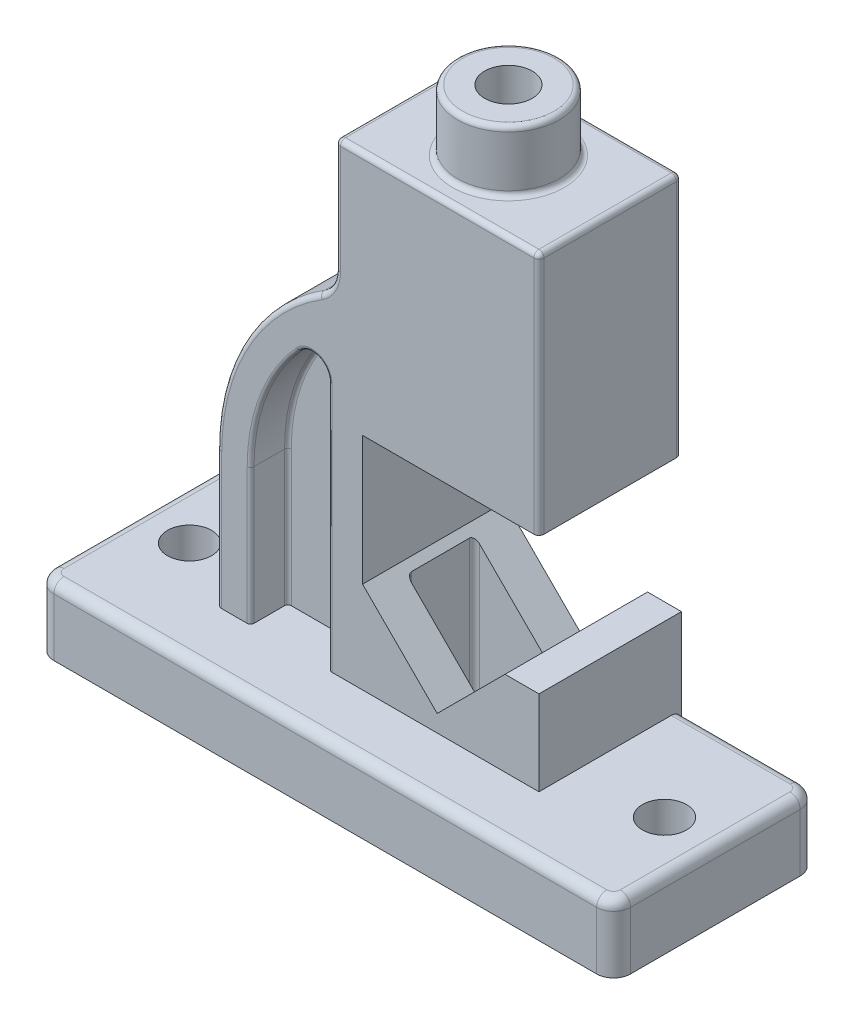
from build123d import *

# Parameters (mm, degrees)
SKETCH1_W              = 170
SKETCH1_H              = 20
BOSS_EXTRUDE1_DEPTH    = 60
BOSS_EXTRUDE2_DEPTH    = 42
BOSS_EXTRUDE3_START    = 11
BOSS_EXTRUDE3_DEPTH    = 20
CUT_EXTRUDE1_START     = 11
SKETCH2_W              = 40
SKETCH2_H              = 147
CUT_EXTRUDE1_DEPTH     = 20
SKETCH3_R              = 15
BOSS_EXTRUDE4_DEPTH    = 18
M16X2_0_TAPPED_HOLE1_D = 14
F_1_0MM_DOWEL_HOLE1_D  = 13
FILLET1_R              = 5
FILLET2_R              = 3
FILLET3_R              = 1.5
FILLET4_R              = 1.5
FILLET5_R              = 1
FILLET6_R              = 1


with BuildPart() as part:
    # Sketch1 → Boss-Extrude1 (new body)
    with BuildSketch(Plane.XY):
        with Locations((-15, 10)):
            Rectangle(SKETCH1_W, SKETCH1_H)
    extrude(amount=BOSS_EXTRUDE1_DEPTH)

    # Sketch1<3> → Boss-Extrude2 (add)
    with BuildSketch(Plane.XY):
        with BuildLine():
            Line((-32, 20), (30, 20))
            Line((30, 20), (30, 45))
            Line((30, 45), (20, 45))
            Line((20, 45), (0, 25))
            Line((0, 25), (-22, 47))
            Line((-22, 47), (-22, 85))
            Line((-22, 85), (30, 85))
            Line((30, 85), (30, 157))
            Line((30, 157), (-30, 157))
            Line((-30, 157), (-30, 123.442887702))
            ThreePointArc((-30, 123.442887702), (-31.244049642, 118.612428787), (-34.666666667, 114.983836009))
            ThreePointArc((-34.666666667, 114.983836009), (-56.913677325, 91.39798295), (-65, 60))
            Line((-65, 60), (-65, 20))
            Line((-65, 20), (-55, 20))
            Line((-55, 20), (-55, 60))
            ThreePointArc((-55, 60), (-51.300584792, 79.830532015), (-40.7, 96.993377786))
            ThreePointArc((-40.7, 96.993377786), (-35.197224362, 98.294032968), (-32, 93.630343442))
            Line((-32, 93.630343442), (-32, 20))
        make_face()
    extrude(amount=BOSS_EXTRUDE2_DEPTH)

    # Sketch1<4> → Boss-Extrude3 (add)
    with BuildSketch(Plane.XY.offset(BOSS_EXTRUDE3_START)):
        with BuildLine():
            Line((-55, 20), (-32, 20))
            Line((-32, 20), (-32, 93.630343442))
            ThreePointArc((-32, 93.630343442), (-35.197224362, 98.294032968), (-40.7, 96.993377786))
            ThreePointArc((-40.7, 96.993377786), (-51.300584792, 79.830532015), (-55, 60))
            Line((-55, 60), (-55, 20))
        make_face()
    extrude(amount=BOSS_EXTRUDE3_DEPTH)

    # Sketch2 → Cut-Extrude1 (cut)
    with BuildSketch(Plane.XY.offset(CUT_EXTRUDE1_START)):
        with Locations((0, 73.5)):
            Rectangle(SKETCH2_W, SKETCH2_H)
    extrude(amount=CUT_EXTRUDE1_DEPTH, mode=Mode.SUBTRACT)

    # Sketch3 → Boss-Extrude4 (add)
    with BuildSketch(Plane(origin=(0, 157, 0), x_dir=(1, 0, 0), z_dir=(0, 1, 0))):
        with Locations(Location((0, -21, 0), (0, 0, 270))):
            Circle(SKETCH3_R)
    extrude(amount=BOSS_EXTRUDE4_DEPTH)

    # M16x2.0 Tapped Hole1 (through all)
    with Locations(Plane(origin=(0, 175, 0), x_dir=(1, 0, 0), z_dir=(0, 1, 0))):
        with Locations((0, -21)):
            Hole(M16X2_0_TAPPED_HOLE1_D / 2)

    # Ø1.0mm Dowel Hole1 (through all)
    with Locations(Plane(origin=(0, 20, 0), x_dir=(1, 0, 0), z_dir=(0, 1, 0))):
        with Locations((55, -30), (-85, -30)):
            Hole(F_1_0MM_DOWEL_HOLE1_D / 2)

    # Fillet1
    fillet1_edges = [part.edges().sort_by_distance(p)[0] for p in [
        (70, 10, 60),
        (-100, 10, 60),
        (-100, 10, 0),
        (70, 10, 0),
    ]]
    fillet(fillet1_edges, radius=FILLET1_R)

    # Fillet2
    fillet2_edges = [part.edges().sort_by_distance(p)[0] for p in [
        (-80, 20, 0),
        (-100, 20, 30),
        (-15, 20, 60),
        (70, 20, 30),
        (68.535533906, 20, 58.535533906),
        (68.535533906, 20, 1.464466094),
        (-98.535533906, 20, 58.535533906),
        (-98.535533906, 20, 1.464466094),
        (47.5, 20, 0),
    ]]
    fillet(fillet2_edges, radius=FILLET2_R)

    # Fillet3
    fillet3_edges = [part.edges().sort_by_distance(p)[0] for p in [
        (-20, 22.5, 11),
        (-20, 147, 21),
        (-20, 116, 11),
        (20, 22.5, 11),
        (20, 116, 11),
        (20, 22.5, 31),
        (-20, 22.5, 31),
        (-20, 116, 31),
        (20, 116, 31),
        (0, 147, 31),
        (0, 147, 11),
        (20, 147, 21),
    ]]
    fillet(fillet3_edges, radius=FILLET3_R)

    # Fillet4
    fillet4_edges = [part.edges().sort_by_distance(p)[0] for p in [
        (0, 157, 6),
        (0, 175, 6),
        (30, 121, 0),
        (0, 157, 0),
        (30, 157, 21),
        (-30, 140.221443851, 0),
        (-30, 157, 21),
        (-31.244049642, 118.612428787, 42),
        (-56.913677325, 91.39798295, 42),
        (-65, 40, 42),
        (30, 121, 42),
        (0, 157, 42),
        (-30, 140.221443851, 42),
        (-65, 38.5, 0),
        (-56.913677325, 91.39798295, 0),
        (-31.244049642, 118.612428787, 0),
    ]]
    fillet(fillet4_edges, radius=FILLET4_R)

    # Fillet5
    fillet5_edges = [part.edges().sort_by_distance(p)[0] for p in [
        (-35.197224362, 98.294032968, 42),
        (-32, 56.815171721, 42),
        (-55, 40, 42),
        (-51.300584792, 79.830532015, 42),
        (-51.300584792, 79.830532015, 31),
        (-55, 40, 31),
        (-32, 56.815171721, 31),
        (-35.197224362, 98.294032968, 31),
    ]]
    fillet(fillet5_edges, radius=FILLET5_R)

    # Fillet6
    fillet6_edges = [part.edges().sort_by_distance(p)[0] for p in [
        (-43.5, 20, 0),
        (-55, 40, 0),
        (-51.300584792, 79.830532015, 0),
        (-35.197224362, 98.294032968, 0),
        (-32, 56.815171721, 0),
        (-55, 20, 5.5),
        (-32, 20, 5.5),
        (-32, 56.815171721, 11),
        (-35.197224362, 98.294032968, 11),
        (-43.5, 20, 11),
        (-55, 40, 11),
        (-51.300584792, 79.830532015, 11),
    ]]
    fillet(fillet6_edges, radius=FILLET6_R)


solid = part.part
